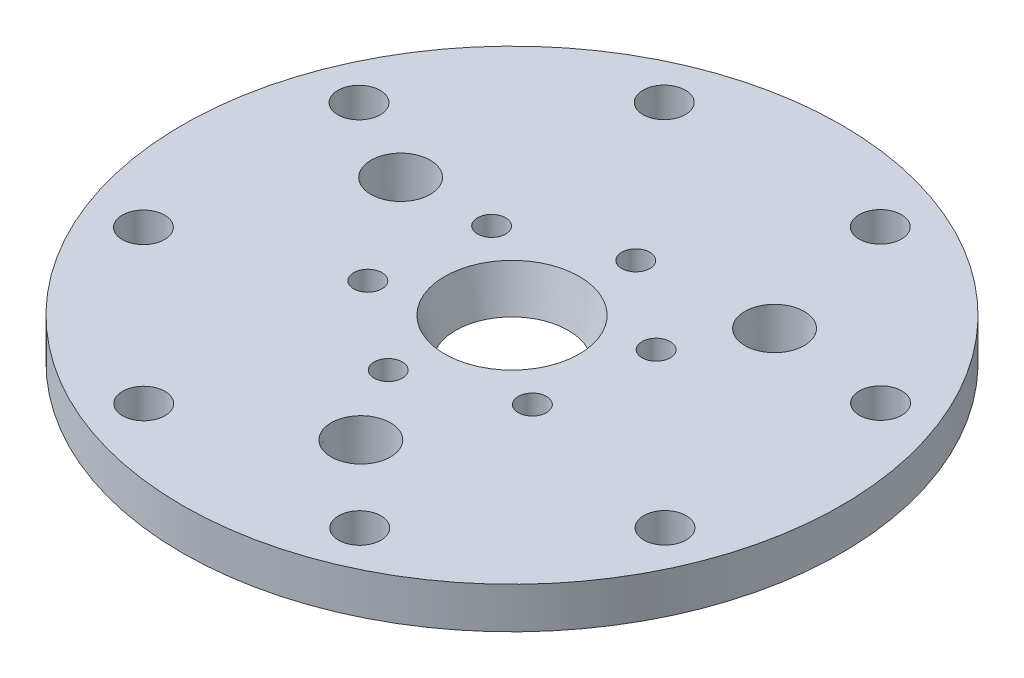
from build123d import *

# Parameters (mm, degrees)
SKETCH1_R               = 76.2
BOSS_EXTRUDE1_DEPTH     = 9.525
CIRPATTERN6_COUNT       = 3
F_3_8_CLEARANCE_HOLE1_D = 9.8044
F_1_4_CLEARANCE_HOLE1_D = 6.5278


with BuildPart() as part:
    # Sketch1 → Boss-Extrude1 (new body)
    with BuildSketch(Plane(origin=(0, 0, 0), x_dir=(1, 0, 0), z_dir=(0, 1, 0))):
        with Locations(Location((0, 0, 0), (0, 0, 90))):
            Circle(SKETCH1_R)
    extrude(amount=BOSS_EXTRUDE1_DEPTH)

    # Sketch5 → Cut-Revolve1 (revolve, cut)
    with BuildSketch(Plane.XY, mode=Mode.PRIVATE) as cut_revolve1_sk:
        Polygon((0, 0), (0, 9.525), (15.552216058, 9.525), (13, 0), align=None)
    revolve(cut_revolve1_sk.sketch.rotate(Axis((0, 0, 0), (0, 1, 0)), 90), axis=Axis((0, 0, 0), (0, 1, 0)), mode=Mode.SUBTRACT)

    # Sketch15 → 1/4 NPT Tapped Hole1 (revolve, cut)
    with BuildSketch(Plane(origin=(33.011727721, 9.525, -27.700128555), x_dir=(0, 0, 1), z_dir=(1, 0, 0))):
        Polygon((0, 0), (0, 9.525), (5.5626, 9.525), (5.5626, 10.0203), (6.557978799, 10.0203), (6.858, 0), align=None)
    f_1_4_npt_tapped_hole1 = revolve(axis=Axis((33.011727721, 15.875, -27.700128555), (0, -1, 0)), mode=Mode.SUBTRACT)

    # CirPattern6: 1/4 NPT Tapped Hole1 ×3 about axis
    cirpattern6_axis = Axis((0, 0, 0), (0, 1, 0))
    for i in range(1, CIRPATTERN6_COUNT):
        add(f_1_4_npt_tapped_hole1.rotate(cirpattern6_axis, i * 360 / CIRPATTERN6_COUNT), mode=Mode.SUBTRACT)

    # 3/8 Clearance Hole1 (through all)
    with Locations(Plane(origin=(0, 9.525, 0), x_dir=(1, 0, 0), z_dir=(0, 1, 0))):
        with Locations((60.207217661, 25.013604371), (60.257374801, -24.888494705), (24.885638551, 60.264250563), (-25.016460514, 60.214093421), (-60.267106699, 24.892514335), (-60.216949569, -25.009584719), (-24.895370482, -60.260230921), (25.006728592, -60.210073801)):
            Hole(F_3_8_CLEARANCE_HOLE1_D / 2)

    # 1/4 Clearance Hole1 (through all)
    with Locations(Plane(origin=(0, 9.525, 0), x_dir=(1, 0, 0), z_dir=(0, 1, 0))):
        with Locations((3.330049479, 25.294237026), (-20.240427094, 15.531025958), (20.240427094, -15.531025958), (-23.570476573, -9.763211068), (-3.330049479, -25.294237026), (23.570476573, 9.763211068)):
            Hole(F_1_4_CLEARANCE_HOLE1_D / 2)


solid = part.part
